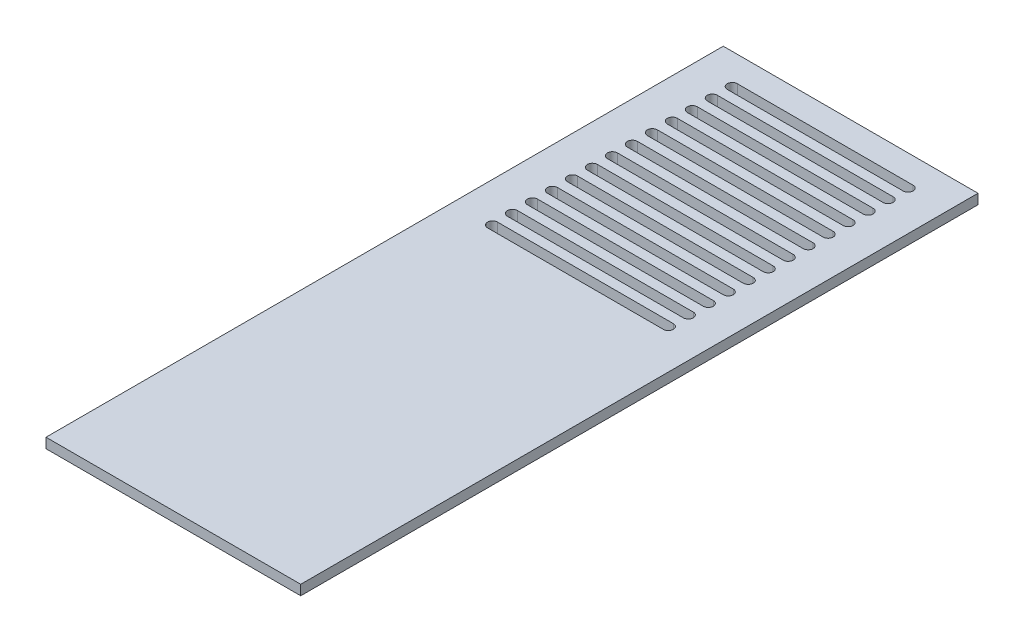
from build123d import *

# Parameters (mm, degrees)
SKETCH1_W           = 51
SKETCH1_H           = 136
BOSS_EXTRUDE1_DEPTH = 2
CUT_EXTRUDE1_DEPTH  = 10
SKETCH5_W           = 1
SKETCH5_H           = 2
BOSS_EXTRUDE2_DEPTH = 136
SKETCH6_W           = 1
SKETCH6_H           = 2
BOSS_EXTRUDE3_DEPTH = 136
SKETCH7_W           = 68.795835126
SKETCH7_H           = 26.425628728
CUT_EXTRUDE2_DEPTH  = 0.4
SKETCH8_W           = 2
SKETCH8_H           = 2
CUT_EXTRUDE3_DEPTH  = 135.6


with BuildPart() as part:
    # Sketch1 → Boss-Extrude1 (new body)
    with BuildSketch(Plane(origin=(0, 0, 0), x_dir=(1, 0, 0), z_dir=(0, 1, 0))):
        with Locations((-30.5, -4.545454545)):
            Rectangle(SKETCH1_W, SKETCH1_H)
    extrude(amount=BOSS_EXTRUDE1_DEPTH)

    # Sketch4 → Cut-Extrude1 (cut)
    with BuildSketch(Plane(origin=(0, 2, 0), x_dir=(1, 0, 0), z_dir=(0, 1, 0))):
        with BuildLine():
            Line((-48.1, 58.354545455), (-12.9, 58.354545455))
            ThreePointArc((-12.9, 58.354545455), (-11.9, 57.354545455), (-12.9, 56.354545455))
            Line((-12.9, 56.354545455), (-48.1, 56.354545455))
            ThreePointArc((-48.1, 56.354545455), (-49.1, 57.354545455), (-48.1, 58.354545455))
        make_face()
        with BuildLine():
            Line((-48.1, 54.354545455), (-12.9, 54.354545455))
            ThreePointArc((-12.9, 54.354545455), (-11.9, 53.354545455), (-12.9, 52.354545455))
            Line((-12.9, 52.354545455), (-48.1, 52.354545455))
            ThreePointArc((-48.1, 52.354545455), (-49.1, 53.354545455), (-48.1, 54.354545455))
        make_face()
        with BuildLine():
            Line((-48.1, 50.354545455), (-12.9, 50.354545455))
            ThreePointArc((-12.9, 50.354545455), (-11.9, 49.354545455), (-12.9, 48.354545455))
            Line((-12.9, 48.354545455), (-48.1, 48.354545455))
            ThreePointArc((-48.1, 48.354545455), (-49.1, 49.354545455), (-48.1, 50.354545455))
        make_face()
        with BuildLine():
            Line((-48.1, 46.354545455), (-12.9, 46.354545455))
            ThreePointArc((-12.9, 46.354545455), (-11.9, 45.354545455), (-12.9, 44.354545455))
            Line((-12.9, 44.354545455), (-48.1, 44.354545455))
            ThreePointArc((-48.1, 44.354545455), (-49.1, 45.354545455), (-48.1, 46.354545455))
        make_face()
        with BuildLine():
            Line((-48.1, 42.354545455), (-12.9, 42.354545455))
            ThreePointArc((-12.9, 42.354545455), (-11.9, 41.354545455), (-12.9, 40.354545455))
            Line((-12.9, 40.354545455), (-48.1, 40.354545455))
            ThreePointArc((-48.1, 40.354545455), (-49.1, 41.354545455), (-48.1, 42.354545455))
        make_face()
        with BuildLine():
            Line((-48.1, 38.354545455), (-12.9, 38.354545455))
            ThreePointArc((-12.9, 38.354545455), (-11.9, 37.354545455), (-12.9, 36.354545455))
            Line((-12.9, 36.354545455), (-48.1, 36.354545455))
            ThreePointArc((-48.1, 36.354545455), (-49.1, 37.354545455), (-48.1, 38.354545455))
        make_face()
        with BuildLine():
            Line((-48.1, 34.354545455), (-12.9, 34.354545455))
            ThreePointArc((-12.9, 34.354545455), (-11.9, 33.354545455), (-12.9, 32.354545455))
            Line((-12.9, 32.354545455), (-48.1, 32.354545455))
            ThreePointArc((-48.1, 32.354545455), (-49.1, 33.354545455), (-48.1, 34.354545455))
        make_face()
        with BuildLine():
            Line((-48.1, 30.354545455), (-12.9, 30.354545455))
            ThreePointArc((-12.9, 30.354545455), (-11.9, 29.354545455), (-12.9, 28.354545455))
            Line((-12.9, 28.354545455), (-48.1, 28.354545455))
            ThreePointArc((-48.1, 28.354545455), (-49.1, 29.354545455), (-48.1, 30.354545455))
        make_face()
        with BuildLine():
            Line((-48.1, 26.354545455), (-12.9, 26.354545455))
            ThreePointArc((-12.9, 26.354545455), (-11.9, 25.354545455), (-12.9, 24.354545455))
            Line((-12.9, 24.354545455), (-48.1, 24.354545455))
            ThreePointArc((-48.1, 24.354545455), (-49.1, 25.354545455), (-48.1, 26.354545455))
        make_face()
        with BuildLine():
            Line((-48.1, 22.354545455), (-12.9, 22.354545455))
            ThreePointArc((-12.9, 22.354545455), (-11.9, 21.354545455), (-12.9, 20.354545455))
            Line((-12.9, 20.354545455), (-48.1, 20.354545455))
            ThreePointArc((-48.1, 20.354545455), (-49.1, 21.354545455), (-48.1, 22.354545455))
        make_face()
        with BuildLine():
            Line((-48.1, 18.354545455), (-12.9, 18.354545455))
            ThreePointArc((-12.9, 18.354545455), (-11.9, 17.354545455), (-12.9, 16.354545455))
            Line((-12.9, 16.354545455), (-48.1, 16.354545455))
            ThreePointArc((-48.1, 16.354545455), (-49.1, 17.354545455), (-48.1, 18.354545455))
        make_face()
        with BuildLine():
            Line((-48.1, 14.354545455), (-12.9, 14.354545455))
            ThreePointArc((-12.9, 14.354545455), (-11.9, 13.354545455), (-12.9, 12.354545455))
            Line((-12.9, 12.354545455), (-48.1, 12.354545455))
            ThreePointArc((-48.1, 12.354545455), (-49.1, 13.354545455), (-48.1, 14.354545455))
        make_face()
        with BuildLine():
            Line((-48.1, 10.354545455), (-12.9, 10.354545455))
            ThreePointArc((-12.9, 10.354545455), (-11.9, 9.354545455), (-12.9, 8.354545455))
            Line((-12.9, 8.354545455), (-48.1, 8.354545455))
            ThreePointArc((-48.1, 8.354545455), (-49.1, 9.354545455), (-48.1, 10.354545455))
        make_face()
    extrude(amount=-CUT_EXTRUDE1_DEPTH, mode=Mode.SUBTRACT)

    # Sketch5 → Boss-Extrude2 (add)
    with BuildSketch(Plane(origin=(0, 0, -63.454545455), x_dir=(-1, 0, 0), z_dir=(0, 0, -1))):
        with Locations((56.5, 1)):
            Rectangle(SKETCH5_W, SKETCH5_H)
        with Locations((4.5, 1)):
            Rectangle(SKETCH5_W, SKETCH5_H)
    extrude(amount=-BOSS_EXTRUDE2_DEPTH)

    # Sketch6 → Boss-Extrude3 (add)
    with BuildSketch(Plane(origin=(0, 0, -63.454545455), x_dir=(-1, 0, 0), z_dir=(0, 0, -1))):
        with Locations((57.5, 1)):
            Rectangle(SKETCH6_W, SKETCH6_H)
        with Locations((3.5, 1)):
            Rectangle(SKETCH6_W, SKETCH6_H)
    extrude(amount=-BOSS_EXTRUDE3_DEPTH)

    # Sketch7 → Cut-Extrude2 (cut)
    with BuildSketch(Plane.XY.offset(72.545454545)):
        with Locations((-32.339758962, -3.400766566)):
            Rectangle(SKETCH7_W, SKETCH7_H)
    extrude(amount=-CUT_EXTRUDE2_DEPTH, mode=Mode.SUBTRACT)

    # Sketch8 → Cut-Extrude3 (cut)
    with BuildSketch(Plane(origin=(0, 0, -63.454545455), x_dir=(-1, 0, 0), z_dir=(0, 0, -1))):
        with Locations((4, 1)):
            Rectangle(SKETCH8_W, SKETCH8_H)
        with Locations((57, 1)):
            Rectangle(SKETCH8_W, SKETCH8_H)
    extrude(amount=-CUT_EXTRUDE3_DEPTH, mode=Mode.SUBTRACT)


solid = part.part
